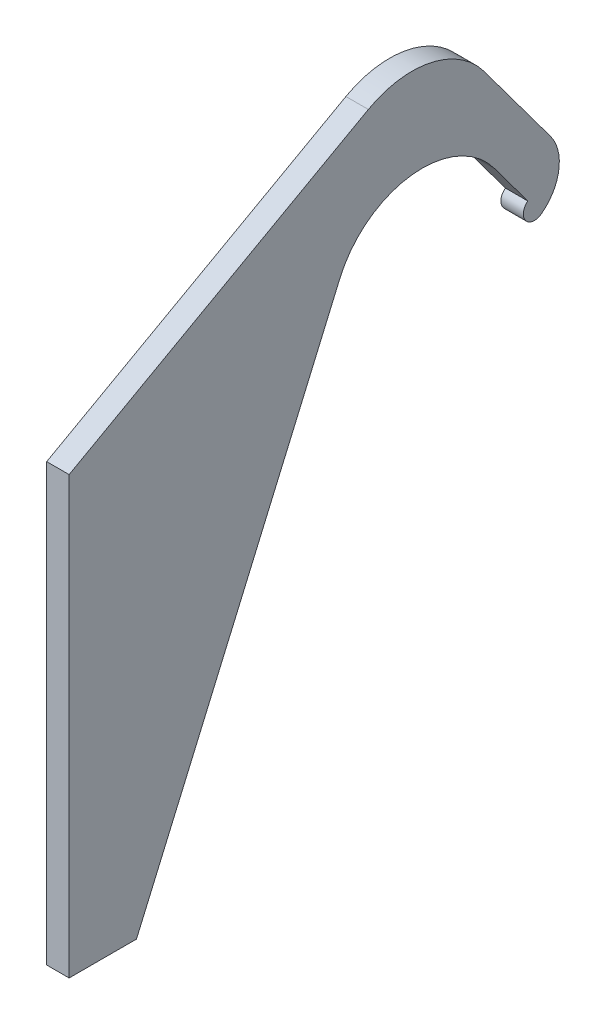
from build123d import *

# Parameters (mm, degrees)
BOSS_EXTRUDE1_DEPTH = 3.175


with BuildPart() as part:
    # Sketch1 → Boss-Extrude1 (new body)
    with BuildSketch(Plane(origin=(0, 0, 0), x_dir=(0, 0, -1), z_dir=(1, 0, 0))):
        with BuildLine():
            Line((0, 0), (9.525, 0))
            Line((9.525, 0), (38.322191876, 66.595518378))
            ThreePointArc((38.322191876, 66.595518378), (48.515936948, 74.170316159), (60.17277679, 69.129672857))
            Line((60.17277679, 69.129672857), (64.907025403, 62.758582188))
            ThreePointArc((64.907025403, 62.758582188), (64.579656991, 60.537514331), (66.800724848, 60.21014592))
            ThreePointArc((66.800724848, 60.21014592), (69.295454529, 64.381080761), (68.110198493, 69.094417346))
            Line((68.110198493, 69.094417346), (58.709682019, 81.745113939))
            ThreePointArc((58.709682019, 81.745113939), (51.186125331, 86.5864385), (42.337451795, 85.266095591))
            Line((42.337451795, 85.266095591), (0, 61.691247253))
            Line((0, 61.691247253), (0, 0))
        make_face()
    extrude(amount=BOSS_EXTRUDE1_DEPTH)


solid = part.part
